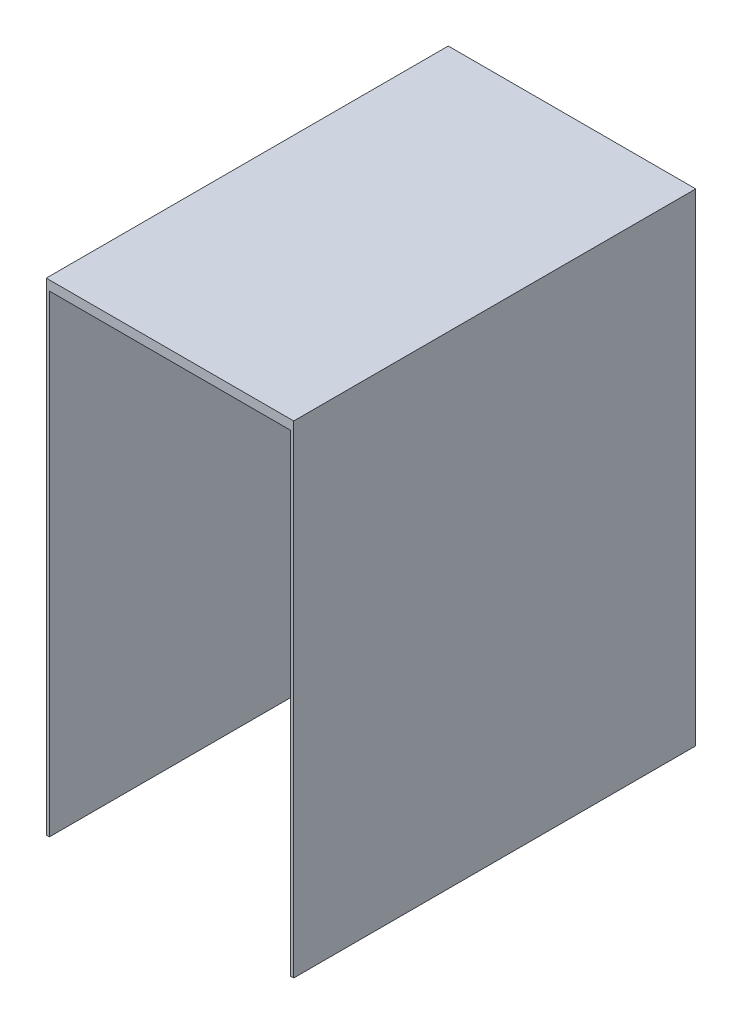
from build123d import *

# Parameters (mm, degrees)
BOSS_EXTRUDE2_DEPTH = 127


with BuildPart() as part:
    # Sketch1 → Boss-Extrude2 (new body)
    with BuildSketch(Plane.XY):
        Polygon((0, 0), (0, 152.4), (78.1812, 152.4), (78.1812, 0), (77.1906, 0), (77.1906, 149.352), (0.9906, 149.352), (0.9906, 0), align=None)
    extrude(amount=BOSS_EXTRUDE2_DEPTH)


solid = part.part
